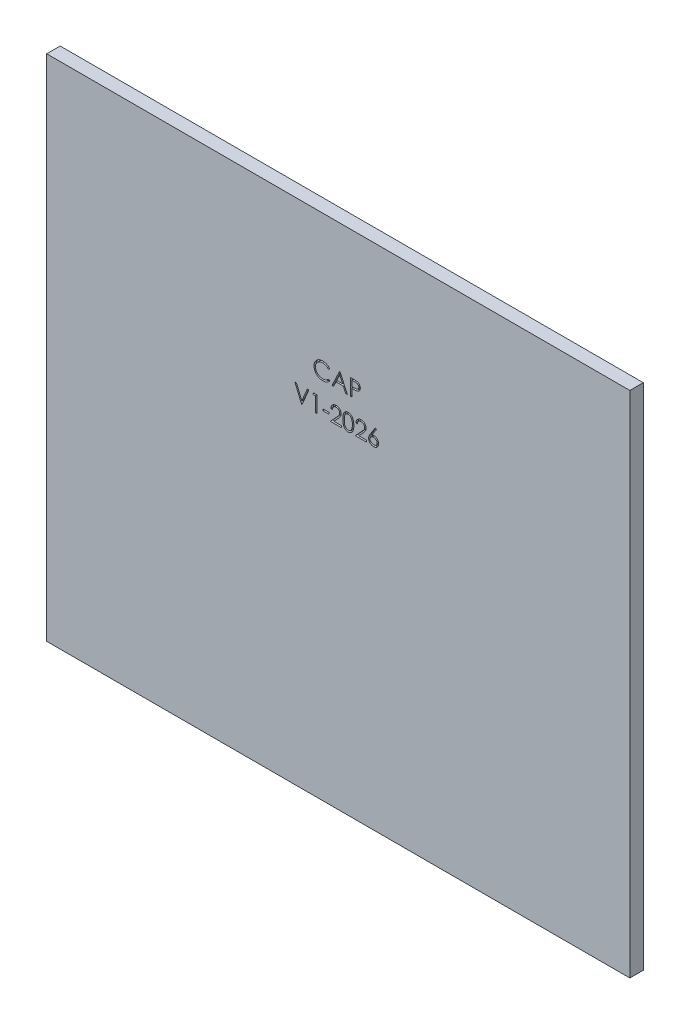
from build123d import *

# Parameters (mm, degrees)
ESQUISSE1_W             = 125.6
ESQUISSE1_H             = 109.6
BOSS_EXTRU_1_DEPTH      = 2.9
ESQUISSE6_W             = 1.346153846
ESQUISSE6_H             = 0.358974359
ENL_V_MAT_EXTRU_1_DEPTH = 0.5


with BuildPart() as part:
    # Esquisse1 → Boss.-Extru.1 (new body)
    with BuildSketch(Plane.XY):
        Rectangle(ESQUISSE1_W, ESQUISSE1_H)
    extrude(amount=BOSS_EXTRU_1_DEPTH)

    # Esquisse6 → Enlèv. mat.-Extru.1 (cut)
    # profile 1 of 10: a face of its own
    with BuildSketch(Plane.XY.offset(2.9)):
        with BuildLine():
            Line((-1.807578887, 26.491864512), (-2.08241863, 26.281527973))
            add(Edge.make_bspline(
                [(-2.08241863, 26.281527973), (-2.102024519, 26.304893943), (-2.140971966, 26.351310859), (-2.203631168, 26.416490403), (-2.268932811, 26.477555665), (-2.336851932, 26.534797544), (-2.408611052, 26.58621431), (-2.48247185, 26.634485413), (-2.559669896, 26.677753151), (-2.66642163, 26.730216137), (-2.806069478, 26.784962292), (-2.981864318, 26.830865523), (-3.165375416, 26.860086699), (-3.290573016, 26.863251541), (-3.354253566, 26.864861307)],
                knots=[0, 0, 0, 0, 0.757959112, 1.505699292, 2.245454638, 2.979532153, 3.711538275, 4.438200793, 5.171680507, 5.909471876, 7.393775596, 8.890124382, 10.418191784, 12, 12, 12, 12], degree=3))
            add(Edge.make_bspline(
                [(-3.354253566, 26.864861307), (-3.389336866, 26.864457344), (-3.459177858, 26.863653168), (-3.562826332, 26.853044043), (-3.664539383, 26.838132833), (-3.764250849, 26.81600751), (-3.861833808, 26.788034891), (-3.95792621, 26.754609477), (-4.051136809, 26.713254637), (-4.142755048, 26.667546377), (-4.230534259, 26.615918932), (-4.313589306, 26.55960558), (-4.391617274, 26.499236484), (-4.464679886, 26.434585377), (-4.532851835, 26.365943417), (-4.595639146, 26.292579075), (-4.652824556, 26.214726902), (-4.705541581, 26.133413494), (-4.752754314, 26.048875703), (-4.792284194, 25.960800632), (-4.827289316, 25.870696529), (-4.854988559, 25.777545368), (-4.876913075, 25.682002603), (-4.892040739, 25.583811815), (-4.90252921, 25.483178135), (-4.903329387, 25.414968822), (-4.903732733, 25.380586467)],
                knots=[0, 0, 0, 0, 1.054917814, 2.100044995, 3.131103042, 4.146048494, 5.169673617, 6.183595914, 7.203665975, 8.234915748, 9.262203917, 10.264457458, 11.251630812, 12.227803204, 13.197192746, 14.159520551, 15.12972552, 16.100847026, 17.073214652, 18.039054194, 19.002613845, 19.979014051, 20.95965708, 21.949030935, 22.966165397, 24, 24, 24, 24], degree=3))
            add(Edge.make_bspline(
                [(-4.903732733, 25.380586467), (-4.902470914, 25.328855147), (-4.8999935, 25.227287562), (-4.877945166, 25.078516952), (-4.844440074, 24.935996278), (-4.794224497, 24.800616435), (-4.732305447, 24.670708077), (-4.654064835, 24.548469224), (-4.563448298, 24.432052659), (-4.459173878, 24.324209712), (-4.344768062, 24.225695986), (-4.222020151, 24.138945405), (-4.091235863, 24.066630522), (-3.953859233, 24.006454576), (-3.808833119, 23.960197848), (-3.656418317, 23.927633725), (-3.496946321, 23.906391544), (-3.387976921, 23.904357856), (-3.332518791, 23.903322845)],
                knots=[0, 0, 0, 0, 1.029171465, 2.020641659, 2.987623507, 3.938342917, 4.889210282, 5.84687017, 6.821220943, 7.821438502, 8.827599549, 9.822697543, 10.807740252, 11.797342354, 12.80366471, 13.83203677, 14.896651826, 16, 16, 16, 16], degree=3))
            add(Edge.make_bspline(
                [(-3.332518791, 23.903322845), (-3.271416102, 23.905011625), (-3.151151393, 23.908335547), (-2.974783366, 23.936494796), (-2.805947601, 23.982152714), (-2.644635014, 24.046050637), (-2.491300368, 24.129115925), (-2.345703708, 24.229813802), (-2.207722137, 24.349102135), (-2.124750855, 24.440185263), (-2.08241863, 24.486656178)],
                knots=[0, 0, 0, 0, 1.028121516, 2.023589091, 2.998037872, 3.967518031, 4.937445131, 5.927275754, 6.942489185, 8, 8, 8, 8], degree=3))
            Line((-2.08241863, 24.486656178), (-1.807578887, 24.278423005))
            add(Edge.make_bspline(
                [(-1.807578887, 24.278423005), (-1.829696997, 24.249884553), (-1.873827272, 24.192944347), (-1.945285289, 24.112672637), (-2.020562586, 24.037168602), (-2.100218296, 23.967040981), (-2.183336088, 23.900886515), (-2.2714084, 23.840584684), (-2.363277433, 23.7852938), (-2.458631912, 23.734666875), (-2.557370524, 23.689749628), (-2.659374959, 23.65129586), (-2.764205535, 23.618170971), (-2.871867043, 23.590919034), (-2.9825828, 23.56964795), (-3.095953274, 23.555428275), (-3.212223149, 23.545686361), (-3.290664571, 23.544798445), (-3.330415425, 23.544348486)],
                knots=[0, 0, 0, 0, 0.986787822, 1.968848986, 2.935600012, 3.899624008, 4.868462664, 5.837806735, 6.815139263, 7.798259679, 8.787526145, 9.778297419, 10.776456485, 11.791383307, 12.812564526, 13.85620153, 14.913611965, 16, 16, 16, 16], degree=3))
            add(Edge.make_bspline(
                [(-3.330415425, 23.544348486), (-3.368059092, 23.544610479), (-3.442494782, 23.545128536), (-3.552393534, 23.553520704), (-3.659383115, 23.564970441), (-3.763157741, 23.582210572), (-3.864283716, 23.602554912), (-3.9618443, 23.629826169), (-4.056799511, 23.660375335), (-4.148767851, 23.696280322), (-4.237827551, 23.736796504), (-4.323691362, 23.782588063), (-4.406319795, 23.833269928), (-4.486525216, 23.887724938), (-4.563122799, 23.94770224), (-4.636776325, 24.012368875), (-4.707898801, 24.081506886), (-4.751901486, 24.131361739), (-4.774025201, 24.156427813)],
                knots=[0, 0, 0, 0, 1.114604814, 2.203992996, 3.262667896, 4.300477797, 5.318619304, 6.316056647, 7.298880507, 8.271930387, 9.238335007, 10.195173496, 11.151986948, 12.108099108, 13.064862484, 14.031167946, 15.010108607, 16, 16, 16, 16], degree=3))
            add(Edge.make_bspline(
                [(-4.774025201, 24.156427813), (-4.809460844, 24.199969002), (-4.879904321, 24.286525712), (-4.970030005, 24.426811694), (-5.04717756, 24.573279902), (-5.109553481, 24.726699831), (-5.158316214, 24.886727218), (-5.192097409, 25.053442733), (-5.214049013, 25.226690675), (-5.216559302, 25.344527464), (-5.217835297, 25.404424608)],
                knots=[0, 0, 0, 0, 0.994628077, 1.977248131, 2.950237994, 3.925870899, 4.908910175, 5.911660606, 6.938484602, 8, 8, 8, 8], degree=3))
            add(Edge.make_bspline(
                [(-5.217835297, 25.404424608), (-5.216280103, 25.467380061), (-5.213220357, 25.591240986), (-5.187224562, 25.773014939), (-5.145405766, 25.947166338), (-5.086008877, 26.113370083), (-5.010703526, 26.272500363), (-4.917676912, 26.423341568), (-4.80800977, 26.566858367), (-4.682562202, 26.700873119), (-4.544994867, 26.823412471), (-4.397676053, 26.931218675), (-4.240894106, 27.020936191), (-4.076376254, 27.095932354), (-3.902890573, 27.153576817), (-3.720807203, 27.193930003), (-3.530468289, 27.21904712), (-3.400605863, 27.222222328), (-3.334622156, 27.223835666)],
                knots=[0, 0, 0, 0, 1.032925535, 2.032216505, 3.007276963, 3.968222605, 4.92396291, 5.891752235, 6.871517503, 7.883894988, 8.900124299, 9.891468569, 10.874487609, 11.85992873, 12.854644235, 13.869047385, 14.917252991, 16, 16, 16, 16], degree=3))
            add(Edge.make_bspline(
                [(-3.334622156, 27.223835666), (-3.294407684, 27.223353527), (-3.214807187, 27.222399183), (-3.097054534, 27.213093041), (-2.982412207, 27.197579435), (-2.870801225, 27.176463365), (-2.761678609, 27.150256044), (-2.655878368, 27.116115745), (-2.552779681, 27.077079214), (-2.453032773, 27.032120748), (-2.357116223, 26.981654007), (-2.265059905, 26.926238383), (-2.177595046, 26.865942578), (-2.094106197, 26.801279402), (-2.015989986, 26.730880843), (-1.941028508, 26.656683247), (-1.87176743, 26.576549423), (-1.829014235, 26.520144489), (-1.807578887, 26.491864512)],
                knots=[0, 0, 0, 0, 1.096760587, 2.17092713, 3.219439832, 4.250915756, 5.268269357, 6.278326846, 7.281116186, 8.274029601, 9.260640565, 10.235837813, 11.203064059, 12.156899882, 13.114053108, 14.069676657, 15.032185724, 16, 16, 16, 16], degree=3))
        make_face()
    # profile 2 of 10: a face of its own
    with BuildSketch(Plane.XY.offset(2.9)):
        Polygon((0.346267267, 27.134092076), (1.961651882, 23.634092076), (1.620205568, 23.634092076), (1.102777684, 24.755886948), (-0.483860938, 24.755886948), (-1.015311259, 23.634092076), (-1.358860938, 23.634092076), (0.301395472, 27.134092076), align=None)
        Polygon((0.320325761, 26.451199448), (-0.31278722, 25.114861307), (0.93731294, 25.114861307), align=None, mode=Mode.SUBTRACT)
    # profile 3 of 10: a face of its own
    with BuildSketch(Plane.XY.offset(2.9)):
        with BuildLine():
            Line((2.589857011, 27.134092076), (3.276255248, 27.134092076))
            add(Edge.make_bspline(
                [(3.276255248, 27.134092076), (3.323466154, 27.13404018), (3.413924347, 27.133940744), (3.543639403, 27.130925998), (3.661449134, 27.126899306), (3.767099515, 27.121317413), (3.860915613, 27.114720823), (3.942472913, 27.105468783), (4.012412469, 27.095808488), (4.054318918, 27.085987081), (4.073430729, 27.081507941)],
                knots=[0, 0, 0, 0, 1.415646017, 2.712440637, 3.8905458, 4.950247383, 5.884950622, 6.709939814, 7.411656543, 8, 8, 8, 8], degree=3))
            add(Edge.make_bspline(
                [(4.073430729, 27.081507941), (4.097624262, 27.074885991), (4.14544124, 27.06179813), (4.214342283, 27.035584406), (4.279896128, 27.004502241), (4.342327687, 26.969078301), (4.40086977, 26.927792737), (4.456395811, 26.882319119), (4.508415791, 26.831607551), (4.556637183, 26.776226811), (4.60092198, 26.717106601), (4.639051663, 26.653364371), (4.67097889, 26.586073068), (4.698362162, 26.515279496), (4.718070616, 26.440389173), (4.732917516, 26.361922461), (4.742341143, 26.27988777), (4.743243705, 26.223827903), (4.743703165, 26.195289992)],
                knots=[0, 0, 0, 0, 0.999701418, 1.975846123, 2.934577507, 3.890451536, 4.834027766, 5.787354733, 6.749476667, 7.726910423, 8.712836071, 9.690891519, 10.682875813, 11.679750201, 12.712814741, 13.765529915, 14.8625177, 16, 16, 16, 16], degree=3))
            add(Edge.make_bspline(
                [(4.743703165, 26.195289992), (4.74328174, 26.166512216), (4.742457194, 26.110206552), (4.732560909, 26.027833764), (4.719230717, 25.949115373), (4.698733665, 25.874225923), (4.671887991, 25.803610152), (4.640395939, 25.73618892), (4.602412408, 25.673109249), (4.558767579, 25.614142131), (4.510215984, 25.559232219), (4.456963046, 25.508777424), (4.399223754, 25.463073086), (4.337181605, 25.422016742), (4.270231757, 25.386560463), (4.199389603, 25.354803158), (4.124039387, 25.328132097), (4.071896873, 25.314102036), (4.045385857, 25.306968678)],
                knots=[0, 0, 0, 0, 1.121902311, 2.195077645, 3.232258892, 4.234102512, 5.217864754, 6.176164875, 7.132989551, 8.084763148, 9.034132444, 9.988522005, 10.94243251, 11.903244335, 12.886203696, 13.894208494, 14.929344452, 16, 16, 16, 16], degree=3))
            add(Edge.make_bspline(
                [(4.045385857, 25.306968678), (4.023458523, 25.302305697), (3.975403495, 25.292086503), (3.896260773, 25.280678046), (3.804115387, 25.270940446), (3.699093107, 25.263639308), (3.581288203, 25.25738894), (3.450636945, 25.252420846), (3.306882868, 25.249690992), (3.206611624, 25.249550199), (3.154260056, 25.249476691)],
                knots=[0, 0, 0, 0, 0.601384939, 1.31797006, 2.144135048, 3.087295005, 4.142315834, 5.309527816, 6.595305764, 8, 8, 8, 8], degree=3))
            Line((3.154260056, 25.249476691), (2.903959575, 25.249476691))
            Line((2.903959575, 25.249476691), (2.903959575, 23.634092076))
            Line((2.903959575, 23.634092076), (2.589857011, 23.634092076))
            Line((2.589857011, 23.634092076), (2.589857011, 27.134092076))
        make_face()
        with BuildLine():
            Line((2.903959575, 26.775117717), (2.903959575, 25.60845105))
            Line((2.903959575, 25.60845105), (3.516740023, 25.60073871))
            add(Edge.make_bspline(
                [(3.516740023, 25.60073871), (3.546659949, 25.600723247), (3.604419749, 25.600693395), (3.687855972, 25.604678618), (3.76526526, 25.609279151), (3.836409835, 25.616015074), (3.90132177, 25.625536332), (3.960109299, 25.63514807), (4.012316581, 25.649053432), (4.073415783, 25.667776501), (4.141499131, 25.699709117), (4.215566679, 25.746059007), (4.278337266, 25.805139715), (4.332655562, 25.871567547), (4.37576144, 25.945466676), (4.407317433, 26.024535613), (4.42585859, 26.107963462), (4.428344784, 26.165051601), (4.4296006, 26.193887749)],
                knots=[0, 0, 0, 0, 1.160613943, 2.240541288, 3.23993089, 4.169200891, 5.011653406, 5.7853311, 6.478053781, 7.106038997, 8.262395093, 9.384106736, 10.481365981, 11.59014053, 12.70357646, 13.786202915, 14.881775077, 16, 16, 16, 16], degree=3))
            add(Edge.make_bspline(
                [(4.4296006, 26.193887749), (4.428337954, 26.222026262), (4.425827969, 26.277962145), (4.407172106, 26.359940905), (4.375822792, 26.43817661), (4.332366197, 26.511149695), (4.279625067, 26.577338499), (4.218325724, 26.634835626), (4.148612463, 26.681057329), (4.083764232, 26.71089061), (4.026163046, 26.729105886), (3.976131086, 26.741850726), (3.919640412, 26.752026332), (3.856672632, 26.760265835), (3.787715798, 26.767319296), (3.712177483, 26.772105274), (3.63034384, 26.77490673), (3.573533269, 26.775045685), (3.544083773, 26.775117717)],
                knots=[0, 0, 0, 0, 1.120700087, 2.227813068, 3.331159281, 4.466773991, 5.599788987, 6.693661531, 7.80175334, 8.91857717, 9.525282508, 10.207424825, 10.974604443, 11.810962634, 12.737642355, 13.736264703, 14.826523623, 16, 16, 16, 16], degree=3))
            Line((3.544083773, 26.775117717), (2.903959575, 26.775117717))
        make_face(mode=Mode.SUBTRACT)
    # profile 4 of 10: a face of its own
    with BuildSketch(Plane.XY.offset(2.9)):
        Polygon((-9.346040425, 20.300758742), (-9.009501964, 20.300758742), (-7.843536419, 17.544648967), (-6.676869752, 20.300758742), (-6.339630169, 20.300758742), (-7.8203994, 16.800758742), (-7.865271194, 16.800758742), align=None)
    # profile 5 of 10: a face of its own
    with BuildSketch(Plane.XY.offset(2.9)):
        Polygon((-5.28163738, 20.300758742), (-4.634501964, 20.300758742), (-4.634501964, 16.800758742), (-4.948604528, 16.800758742), (-4.948604528, 19.941784384), (-5.487066066, 19.941784384), align=None)
    # profile 6 of 10: a face of its own
    with BuildSketch(Plane.XY.offset(2.9)):
        with Locations((-2.660142989, 18.146912589)):
            Rectangle(ESQUISSE6_W, ESQUISSE6_H)
    # profile 7 of 10: a face of its own
    with BuildSketch(Plane.XY.offset(2.9)):
        with BuildLine():
            Line((-1.269117348, 19.223835666), (-1.583219912, 19.223835666))
            add(Edge.make_bspline(
                [(-1.583219912, 19.223835666), (-1.581172759, 19.265506553), (-1.577152205, 19.347347068), (-1.558323916, 19.466670974), (-1.531383039, 19.580725773), (-1.493291585, 19.688595687), (-1.445985307, 19.791234494), (-1.38925528, 19.88823451), (-1.322061429, 19.979225699), (-1.245854695, 20.063364542), (-1.163086056, 20.140552113), (-1.073780117, 20.207207356), (-0.979935089, 20.263525027), (-0.88183569, 20.310606269), (-0.778375127, 20.345946115), (-0.670492269, 20.372167754), (-0.557713133, 20.3879441), (-0.480873111, 20.389639886), (-0.44179363, 20.390502332)],
                knots=[0, 0, 0, 0, 1.10065271, 2.161652631, 3.183658789, 4.190468796, 5.17591951, 6.163126047, 7.15150782, 8.156236427, 9.156009102, 10.134482811, 11.092018607, 12.041330605, 13.001268258, 13.972401359, 14.968799086, 16, 16, 16, 16], degree=3))
            add(Edge.make_bspline(
                [(-0.44179363, 20.390502332), (-0.403415556, 20.389603876), (-0.328004012, 20.387838441), (-0.217941997, 20.372677412), (-0.113164703, 20.34893182), (-0.013876936, 20.315616404), (0.079129128, 20.270831976), (0.166552173, 20.217034438), (0.249432984, 20.154814606), (0.324039767, 20.081560793), (0.392547847, 20.003358408), (0.451650102, 19.919870505), (0.502263265, 19.833641219), (0.544450945, 19.744013018), (0.575507084, 19.650141989), (0.599085292, 19.553394786), (0.612412706, 19.452769975), (0.614458129, 19.38466342), (0.615498036, 19.350037589)],
                knots=[0, 0, 0, 0, 1.111607364, 2.184268762, 3.212621178, 4.221274766, 5.211760367, 6.196651075, 7.1921475, 8.207485113, 9.220403448, 10.201281604, 11.166441695, 12.114753415, 13.065576456, 14.026450734, 14.996634279, 16, 16, 16, 16], degree=3))
            add(Edge.make_bspline(
                [(0.615498036, 19.350037589), (0.613811391, 19.301287779), (0.6104677, 19.204643651), (0.581611997, 19.062439294), (0.5370299, 18.924534234), (0.482956871, 18.813555182), (0.428336303, 18.724578289), (0.380156508, 18.650662648), (0.322504155, 18.571836231), (0.255906742, 18.487305122), (0.181368935, 18.396810752), (0.098354268, 18.300315986), (0.006228577, 18.198845681), (-0.058429605, 18.129539868), (-0.091933855, 18.093627332)],
                knots=[0, 0, 0, 0, 1.184203166, 2.347625244, 3.513805382, 4.700623107, 5.337941753, 6.051866363, 6.845199593, 7.711357327, 8.668078039, 9.695487809, 10.805859518, 12, 12, 12, 12], degree=3))
            Line((-0.091933855, 18.093627332), (-0.967634977, 17.159733101))
            Line((-0.967634977, 17.159733101), (0.660369831, 17.159733101))
            Line((0.660369831, 17.159733101), (0.660369831, 16.800758742))
            Line((0.660369831, 16.800758742), (-1.717835297, 16.800758742))
            Line((-1.717835297, 16.800758742), (-0.360463502, 18.249276371))
            add(Edge.make_bspline(
                [(-0.360463502, 18.249276371), (-0.327415615, 18.283774677), (-0.263937388, 18.350038864), (-0.174154811, 18.446781824), (-0.093515823, 18.536531365), (-0.02149843, 18.619117913), (0.040335075, 18.695749481), (0.095207307, 18.763944185), (0.139172898, 18.826698635), (0.186888294, 18.899439249), (0.233102275, 18.988251566), (0.272814631, 19.096785255), (0.29702948, 19.208512508), (0.299934315, 19.284014545), (0.301395472, 19.321992717)],
                knots=[0, 0, 0, 0, 1.329631726, 2.553950428, 3.673215718, 4.687767853, 5.603093632, 6.413772471, 7.123043292, 7.734684054, 8.834405432, 9.900288307, 10.943827018, 12, 12, 12, 12], degree=3))
            add(Edge.make_bspline(
                [(0.301395472, 19.321992717), (0.30075973, 19.345874115), (0.299506804, 19.392939766), (0.288449106, 19.461945525), (0.2717386, 19.528510338), (0.247793342, 19.592838958), (0.216186602, 19.65428461), (0.177713222, 19.71292209), (0.133323159, 19.769611055), (0.08197189, 19.822764353), (0.02556037, 19.871445559), (-0.03403388, 19.914569644), (-0.097083984, 19.950608755), (-0.163324106, 19.980152252), (-0.232569576, 20.003327633), (-0.304954321, 20.019386213), (-0.380278337, 20.029468697), (-0.431711833, 20.030832868), (-0.457919432, 20.031527973)],
                knots=[0, 0, 0, 0, 0.991446411, 1.95395049, 2.89581595, 3.838931463, 4.798493298, 5.75982156, 6.748411868, 7.785213223, 8.824556874, 9.840280684, 10.836137867, 11.835679398, 12.848801643, 13.863922112, 14.911575587, 16, 16, 16, 16], degree=3))
            add(Edge.make_bspline(
                [(-0.457919432, 20.031527973), (-0.485290264, 20.030812941), (-0.539042061, 20.029408736), (-0.617961094, 20.019586072), (-0.693246871, 20.002640231), (-0.765088774, 19.979463557), (-0.83360836, 19.950005008), (-0.898472404, 19.913313263), (-0.959535293, 19.86952977), (-1.016911816, 19.819889214), (-1.069775796, 19.764621613), (-1.116222671, 19.70301165), (-1.156806686, 19.636184234), (-1.192215919, 19.564319684), (-1.220971609, 19.486765904), (-1.24294476, 19.403798199), (-1.260331606, 19.315776817), (-1.266140127, 19.254991733), (-1.269117348, 19.223835666)],
                knots=[0, 0, 0, 0, 1.031018746, 2.02475058, 2.990194455, 3.934040569, 4.864654155, 5.795059489, 6.735614925, 7.690564532, 8.649604399, 9.611025574, 10.590972636, 11.591080095, 12.624614302, 13.701020113, 14.821632451, 16, 16, 16, 16], degree=3))
        make_face()
    # profile 8 of 10: a face of its own
    with BuildSketch(Plane.XY.offset(2.9)):
        with BuildLine():
            add(Edge.make_bspline(
                [(0.974472395, 18.549356499), (0.974800413, 18.605453887), (0.975437593, 18.714423871), (0.982526014, 18.873208513), (0.994301357, 19.022168802), (1.01043873, 19.161311868), (1.03007671, 19.290673633), (1.056292196, 19.40990839), (1.086104999, 19.519567996), (1.120657445, 19.620010045), (1.159645234, 19.712587748), (1.202079495, 19.799012949), (1.249644289, 19.879154881), (1.299621202, 19.954292672), (1.354033274, 20.023196367), (1.411332064, 20.086839029), (1.47375394, 20.14374978), (1.539176949, 20.195596082), (1.608193413, 20.241045554), (1.678836079, 20.281078292), (1.751591185, 20.31527816), (1.826657368, 20.342168595), (1.903359926, 20.364379442), (1.981966992, 20.37956839), (2.062608356, 20.389125298), (2.117039791, 20.390038966), (2.144644671, 20.390502332)],
                knots=[0, 0, 0, 0, 1.646270934, 3.197905019, 4.663502075, 6.030701355, 7.308322542, 8.50163776, 9.611534131, 10.641858119, 11.616356847, 12.558055219, 13.465016945, 14.349605745, 15.204443733, 16.039544428, 16.859896111, 17.680448484, 18.487036065, 19.28249412, 20.06191084, 20.843045899, 21.620316918, 22.403196591, 23.190181807, 24, 24, 24, 24], degree=3))
            add(Edge.make_bspline(
                [(2.144644671, 20.390502332), (2.172480149, 20.390014517), (2.227836158, 20.389044406), (2.309676534, 20.379720464), (2.389626215, 20.364249341), (2.467344354, 20.342328366), (2.54346934, 20.315132689), (2.617405748, 20.281045572), (2.68961283, 20.241366705), (2.758943117, 20.194742828), (2.826157733, 20.142760551), (2.889605696, 20.083997883), (2.949292781, 20.019048163), (3.005968087, 19.948606299), (3.058023684, 19.871321215), (3.107597116, 19.788537105), (3.151969152, 19.69880624), (3.194703827, 19.603625772), (3.231590814, 19.500362113), (3.264857059, 19.389597353), (3.291736028, 19.270023166), (3.3141253, 19.142266921), (3.331470196, 19.005859437), (3.344102838, 18.861093122), (3.350775923, 18.707872731), (3.352032625, 18.603114882), (3.352677523, 18.549356499)],
                knots=[0, 0, 0, 0, 0.810914788, 1.612654377, 2.396697861, 3.181598691, 3.963628158, 4.749916497, 5.551656086, 6.361998678, 7.18212741, 8.025565596, 8.878627764, 9.750805457, 10.657531673, 11.591944965, 12.560506719, 13.57287815, 14.630710178, 15.753379473, 16.941251878, 18.199788006, 19.531962791, 20.947069417, 22.433333509, 24, 24, 24, 24], degree=3))
            add(Edge.make_bspline(
                [(3.352677523, 18.549356499), (3.352025939, 18.495832591), (3.350756353, 18.391543439), (3.344177646, 18.239012464), (3.331219015, 18.09501442), (3.315009027, 17.959203958), (3.292558064, 17.832146339), (3.264952898, 17.713401891), (3.234302575, 17.602457819), (3.196467781, 17.500223007), (3.15505707, 17.405271285), (3.110001874, 17.316604136), (3.061732048, 17.233437844), (3.009143303, 17.156438097), (2.95308989, 17.08505944), (2.892372101, 17.020561817), (2.828701516, 16.961391145), (2.7612891, 16.908739517), (2.690877549, 16.862654713), (2.618918472, 16.821440862), (2.544135089, 16.788208167), (2.468222136, 16.759673126), (2.39009377, 16.737872675), (2.309847379, 16.722798819), (2.227891143, 16.712226971), (2.172489578, 16.711420491), (2.144644671, 16.711015153)],
                knots=[0, 0, 0, 0, 1.561518951, 3.042555995, 4.452378317, 5.7783523, 7.031515105, 8.214008947, 9.334062868, 10.386615937, 11.391082383, 12.354592575, 13.286541444, 14.194233754, 15.072674879, 15.931287219, 16.775624067, 17.606195743, 18.42308326, 19.229000347, 20.022332153, 20.807536673, 21.593273796, 22.3848459, 23.188221202, 24, 24, 24, 24], degree=3))
            add(Edge.make_bspline(
                [(2.144644671, 16.711015153), (2.117040557, 16.711481508), (2.062610632, 16.71240107), (1.981958207, 16.721914802), (1.903675763, 16.737210305), (1.827377009, 16.758626909), (1.752670494, 16.784841745), (1.680574208, 16.818995429), (1.610286524, 16.858329498), (1.541994968, 16.903124919), (1.476982807, 16.954446602), (1.414884201, 17.011210891), (1.357259182, 17.074834302), (1.303625087, 17.144312225), (1.252650999, 17.219005468), (1.205761625, 17.299933841), (1.162390771, 17.386776451), (1.12274728, 17.480094362), (1.087598617, 17.58124929), (1.056550909, 17.691398468), (1.032036751, 17.811514104), (1.011053796, 17.940631472), (0.994129413, 18.079305402), (0.982575088, 18.22761118), (0.975433773, 18.385456389), (0.974798702, 18.493726163), (0.974472395, 18.549356499)],
                knots=[0, 0, 0, 0, 0.810891512, 1.598919785, 2.382837074, 3.152667961, 3.926044502, 4.706494248, 5.493654104, 6.291793342, 7.103789334, 7.925228297, 8.761435821, 9.622817696, 10.50288917, 11.416980706, 12.369136599, 13.353924996, 14.394355917, 15.514179734, 16.714354668, 17.994756427, 19.357759367, 20.818452758, 22.365282078, 24, 24, 24, 24], degree=3))
        make_face()
        with BuildLine():
            add(Edge.make_bspline(
                [(1.288574959, 18.550758742), (1.288694406, 18.504010044), (1.28892623, 18.413279999), (1.29498243, 18.281436738), (1.303232662, 18.158466409), (1.31387396, 18.044212873), (1.329676908, 17.93906286), (1.347383696, 17.842293177), (1.368931785, 17.75441594), (1.394426803, 17.674828129), (1.4234659, 17.602179061), (1.455171764, 17.534577846), (1.489232487, 17.471225909), (1.527351637, 17.412692301), (1.568866701, 17.358786137), (1.61283996, 17.308553304), (1.660912544, 17.263756323), (1.727416287, 17.210029468), (1.815212761, 17.154510334), (1.925833216, 17.106164244), (2.039501667, 17.075781788), (2.116652917, 17.071918032), (2.155161498, 17.069989512)],
                knots=[0, 0, 0, 0, 1.459021318, 2.831673884, 4.118529203, 5.306027144, 6.411944654, 7.436330062, 8.375795394, 9.233974572, 10.042671642, 10.816086306, 11.563610507, 12.285937304, 12.993564865, 13.685989202, 14.367179055, 15.041617293, 16.353048772, 17.594441528, 18.799311195, 20, 20, 20, 20], degree=3))
            add(Edge.make_bspline(
                [(2.155161498, 17.069989512), (2.19391917, 17.071587293), (2.271354493, 17.074779555), (2.384488288, 17.105578293), (2.494318558, 17.152047832), (2.580390498, 17.206995338), (2.645873042, 17.259323667), (2.692790032, 17.303938315), (2.73585208, 17.353894183), (2.776694155, 17.407793479), (2.814153231, 17.466665963), (2.848216368, 17.530228538), (2.879299716, 17.598657716), (2.897008762, 17.646427455), (2.90606294, 17.67085089)],
                knots=[0, 0, 0, 0, 1.353760809, 2.704726607, 4.075137775, 5.516104923, 6.260822281, 7.007110065, 7.778089737, 8.566572457, 9.372053459, 10.217411131, 11.088608312, 12, 12, 12, 12], degree=3))
            add(Edge.make_bspline(
                [(2.90606294, 17.67085089), (2.916614708, 17.702080629), (2.938039322, 17.765490394), (2.965651096, 17.863854046), (2.987396495, 17.96705681), (3.006959861, 18.074481926), (3.020312917, 18.186921627), (3.03106073, 18.304028011), (3.037391417, 18.425889374), (3.038176168, 18.508684365), (3.038574959, 18.550758742)],
                knots=[0, 0, 0, 0, 0.884706709, 1.796334032, 2.740027952, 3.714592787, 4.726048262, 5.777819803, 6.87074269, 8, 8, 8, 8], degree=3))
            add(Edge.make_bspline(
                [(3.038574959, 18.550758742), (3.03802477, 18.592826315), (3.036948482, 18.67511948), (3.032834495, 18.79563766), (3.02221092, 18.910105421), (3.010411801, 19.019015894), (2.99301458, 19.121766197), (2.974256773, 19.219216502), (2.949055561, 19.310159527), (2.922135786, 19.396019109), (2.891325391, 19.475819763), (2.857409656, 19.549933549), (2.821187898, 19.618718274), (2.781845657, 19.681985216), (2.739849974, 19.740017759), (2.694092425, 19.791652353), (2.646388052, 19.838489321), (2.579570866, 19.89195189), (2.492096576, 19.946463586), (2.383250929, 19.996629346), (2.269980285, 20.025437638), (2.193406831, 20.029499325), (2.155161498, 20.031527973)],
                knots=[0, 0, 0, 0, 1.31362396, 2.569729283, 3.763502607, 4.902122613, 5.988968491, 7.01645872, 7.998833611, 8.933434873, 9.825090667, 10.667526885, 11.477055099, 12.250526234, 12.991942729, 13.710640831, 14.402115721, 15.076753259, 16.378508321, 17.609869233, 18.806226677, 20, 20, 20, 20], degree=3))
            add(Edge.make_bspline(
                [(2.155161498, 20.031527973), (2.116450906, 20.029496527), (2.0389592, 20.025429933), (1.924511245, 19.996736679), (1.814806894, 19.946723713), (1.727563919, 19.891771341), (1.660700133, 19.839433029), (1.613617439, 19.794046575), (1.569471267, 19.744400321), (1.528803567, 19.689998406), (1.490714284, 19.631533038), (1.455733271, 19.568544274), (1.424215941, 19.50071291), (1.395131405, 19.428096474), (1.369558617, 19.34851553), (1.348464654, 19.260746536), (1.328977601, 19.164284644), (1.315182332, 19.058565136), (1.302918576, 18.944282983), (1.295037228, 18.821005665), (1.288905971, 18.688941284), (1.288687506, 18.597742126), (1.288574959, 18.550758742)],
                knots=[0, 0, 0, 0, 1.207732386, 2.417664972, 3.655092373, 4.956220595, 5.625982001, 6.301752483, 6.994047911, 7.697131622, 8.419323945, 9.170223765, 9.943494443, 10.752040957, 11.610060368, 12.549350801, 13.567764191, 14.679664412, 15.874934091, 17.154273443, 18.533957287, 20, 20, 20, 20], degree=3))
        make_face(mode=Mode.SUBTRACT)
    # profile 9 of 10: a face of its own
    with BuildSketch(Plane.XY.offset(2.9)):
        with BuildLine():
            Line((4.115498036, 19.223835666), (3.801395472, 19.223835666))
            add(Edge.make_bspline(
                [(3.801395472, 19.223835666), (3.803442625, 19.265506553), (3.807463179, 19.347347068), (3.826291469, 19.466670974), (3.853232346, 19.580725773), (3.8913238, 19.688595687), (3.938630078, 19.791234494), (3.995360105, 19.88823451), (4.062553955, 19.979225699), (4.138760689, 20.063364542), (4.221529328, 20.140552113), (4.310835268, 20.207207356), (4.404680295, 20.263525027), (4.502779694, 20.310606269), (4.606240258, 20.345946115), (4.714123116, 20.372167754), (4.826902252, 20.3879441), (4.903742274, 20.389639886), (4.942821754, 20.390502332)],
                knots=[0, 0, 0, 0, 1.10065271, 2.161652631, 3.183658789, 4.190468796, 5.17591951, 6.163126047, 7.15150782, 8.156236427, 9.156009102, 10.134482811, 11.092018607, 12.041330605, 13.001268258, 13.972401359, 14.968799086, 16, 16, 16, 16], degree=3))
            add(Edge.make_bspline(
                [(4.942821754, 20.390502332), (4.981199828, 20.389603876), (5.056611373, 20.387838441), (5.166673387, 20.372677412), (5.271450682, 20.34893182), (5.370738448, 20.315616404), (5.463744513, 20.270831976), (5.551167558, 20.217034438), (5.634048368, 20.154814606), (5.708655152, 20.081560793), (5.777163231, 20.003358408), (5.836265486, 19.919870505), (5.88687865, 19.833641219), (5.92906633, 19.744013018), (5.960122469, 19.650141989), (5.983700677, 19.553394786), (5.99702809, 19.452769975), (5.999073514, 19.38466342), (6.000113421, 19.350037589)],
                knots=[0, 0, 0, 0, 1.111607364, 2.184268762, 3.212621178, 4.221274766, 5.211760367, 6.196651075, 7.1921475, 8.207485113, 9.220403448, 10.201281604, 11.166441695, 12.114753415, 13.065576456, 14.026450734, 14.996634279, 16, 16, 16, 16], degree=3))
            add(Edge.make_bspline(
                [(6.000113421, 19.350037589), (5.998426776, 19.301287779), (5.995083084, 19.204643651), (5.966227382, 19.062439294), (5.921645285, 18.924534234), (5.867572256, 18.813555182), (5.812951688, 18.724578289), (5.764771892, 18.650662648), (5.707119539, 18.571836231), (5.640522126, 18.487305122), (5.56598432, 18.396810752), (5.482969652, 18.300315986), (5.390843962, 18.198845681), (5.32618578, 18.129539868), (5.29268153, 18.093627332)],
                knots=[0, 0, 0, 0, 1.184203166, 2.347625244, 3.513805382, 4.700623107, 5.337941753, 6.051866363, 6.845199593, 7.711357327, 8.668078039, 9.695487809, 10.805859518, 12, 12, 12, 12], degree=3))
            Line((5.29268153, 18.093627332), (4.416980408, 17.159733101))
            Line((4.416980408, 17.159733101), (6.044985216, 17.159733101))
            Line((6.044985216, 17.159733101), (6.044985216, 16.800758742))
            Line((6.044985216, 16.800758742), (3.666780088, 16.800758742))
            Line((3.666780088, 16.800758742), (5.024151882, 18.249276371))
            add(Edge.make_bspline(
                [(5.024151882, 18.249276371), (5.057199769, 18.283774677), (5.120677996, 18.350038864), (5.210460573, 18.446781824), (5.291099562, 18.536531365), (5.363116954, 18.619117913), (5.42495046, 18.695749481), (5.479822692, 18.763944185), (5.523788283, 18.826698635), (5.571503678, 18.899439249), (5.61771766, 18.988251566), (5.657430016, 19.096785255), (5.681644864, 19.208512508), (5.6845497, 19.284014545), (5.686010857, 19.321992717)],
                knots=[0, 0, 0, 0, 1.329631726, 2.553950428, 3.673215718, 4.687767853, 5.603093632, 6.413772471, 7.123043292, 7.734684054, 8.834405432, 9.900288307, 10.943827018, 12, 12, 12, 12], degree=3))
            add(Edge.make_bspline(
                [(5.686010857, 19.321992717), (5.685375115, 19.345874115), (5.684122189, 19.392939766), (5.673064491, 19.461945525), (5.656353985, 19.528510338), (5.632408727, 19.592838958), (5.600801987, 19.65428461), (5.562328607, 19.71292209), (5.517938543, 19.769611055), (5.466587274, 19.822764353), (5.410175754, 19.871445559), (5.350581505, 19.914569644), (5.287531401, 19.950608755), (5.221291278, 19.980152252), (5.152045809, 20.003327633), (5.079661064, 20.019386213), (5.004337048, 20.029468697), (4.952903552, 20.030832868), (4.926695953, 20.031527973)],
                knots=[0, 0, 0, 0, 0.991446411, 1.95395049, 2.89581595, 3.838931463, 4.798493298, 5.75982156, 6.748411868, 7.785213223, 8.824556874, 9.840280684, 10.836137867, 11.835679398, 12.848801643, 13.863922112, 14.911575587, 16, 16, 16, 16], degree=3))
            add(Edge.make_bspline(
                [(4.926695953, 20.031527973), (4.89932512, 20.030812941), (4.845573324, 20.029408736), (4.766654291, 20.019586072), (4.691368514, 20.002640231), (4.619526611, 19.979463557), (4.551007025, 19.950005008), (4.486142981, 19.913313263), (4.425080091, 19.86952977), (4.367703568, 19.819889214), (4.314839589, 19.764621613), (4.268392713, 19.70301165), (4.227808699, 19.636184234), (4.192399466, 19.564319684), (4.163643776, 19.486765904), (4.141670625, 19.403798199), (4.124283778, 19.315776817), (4.118475258, 19.254991733), (4.115498036, 19.223835666)],
                knots=[0, 0, 0, 0, 1.031018746, 2.02475058, 2.990194455, 3.934040569, 4.864654155, 5.795059489, 6.735614925, 7.690564532, 8.649604399, 9.611025574, 10.590972636, 11.591080095, 12.624614302, 13.701020113, 14.821632451, 16, 16, 16, 16], degree=3))
        make_face()
    # profile 10 of 10: a face of its own
    with BuildSketch(Plane.XY.offset(2.9)):
        with BuildLine():
            Line((7.974472395, 20.390502332), (8.217060536, 20.200498326))
            Line((8.217060536, 20.200498326), (7.292280889, 18.786335666))
            add(Edge.make_bspline(
                [(7.292280889, 18.786335666), (7.353851166, 18.796149526), (7.473950953, 18.815292571), (7.595516851, 18.818450516), (7.654760857, 18.819989512)],
                knots=[0, 0, 0, 0, 1.025318673, 2, 2, 2, 2], degree=3))
            add(Edge.make_bspline(
                [(7.654760857, 18.819989512), (7.690335143, 18.819047248), (7.760130452, 18.817198564), (7.862684886, 18.802588984), (7.961252279, 18.779849254), (8.055612741, 18.746568277), (8.145886029, 18.704068245), (8.232588342, 18.653128744), (8.314090375, 18.591123237), (8.391441548, 18.521858233), (8.461668647, 18.445141261), (8.523844702, 18.363739921), (8.576071494, 18.277739041), (8.618445416, 18.187182175), (8.651350294, 18.092208916), (8.675337939, 17.992940776), (8.689517532, 17.889309305), (8.691443023, 17.818831129), (8.692421113, 17.783030377)],
                knots=[0, 0, 0, 0, 1.044136307, 2.048553127, 3.035567123, 4.010001674, 4.980053131, 5.96154148, 6.956538004, 7.981742224, 9.006487041, 10.005615874, 10.984750588, 11.954802044, 12.935714515, 13.930994945, 14.949008866, 16, 16, 16, 16], degree=3))
            add(Edge.make_bspline(
                [(8.692421113, 17.783030377), (8.690998008, 17.734050673), (8.688197675, 17.637670207), (8.660293879, 17.497293501), (8.616934234, 17.363560985), (8.554956706, 17.238607814), (8.477974323, 17.122605244), (8.38409673, 17.019819779), (8.276653242, 16.928149742), (8.155166443, 16.851493122), (8.024423479, 16.788890071), (7.887071482, 16.743924829), (7.744444336, 16.71624136), (7.647639727, 16.712770757), (7.598671113, 16.711015153)],
                knots=[0, 0, 0, 0, 1.031375318, 2.029502543, 3.004789286, 3.987476834, 4.960371455, 5.9300674, 6.912260825, 7.929083631, 8.949397511, 9.960523116, 10.96833055, 12, 12, 12, 12], degree=3))
            add(Edge.make_bspline(
                [(7.598671113, 16.711015153), (7.551574413, 16.712543358), (7.458284095, 16.715570467), (7.3210513, 16.742536404), (7.189188283, 16.786243507), (7.063618902, 16.846457786), (6.947298289, 16.922515669), (6.843232653, 17.014077948), (6.751940878, 17.119187413), (6.675966257, 17.23782776), (6.615707525, 17.365317718), (6.5705176, 17.498254874), (6.544121357, 17.636154856), (6.5404328, 17.729635995), (6.538574959, 17.776720281)],
                knots=[0, 0, 0, 0, 1.012016664, 2.004627821, 2.994792927, 3.992885782, 4.990978636, 5.973936114, 6.964471063, 7.975201453, 8.993600317, 9.990122807, 10.98767138, 12, 12, 12, 12], degree=3))
            add(Edge.make_bspline(
                [(6.538574959, 17.776720281), (6.539756404, 17.812764864), (6.542168689, 17.886361016), (6.55901208, 17.997825044), (6.586076874, 18.111876126), (6.616387121, 18.208630319), (6.648412731, 18.287891841), (6.67506527, 18.351795332), (6.708239267, 18.417556405), (6.743612648, 18.487430041), (6.784369517, 18.559615474), (6.828685166, 18.635319143), (6.877784817, 18.713337071), (6.91220498, 18.766281266), (6.929800921, 18.793346884)],
                knots=[0, 0, 0, 0, 1.173818275, 2.396712641, 3.66331629, 4.989737886, 5.693666774, 6.447286557, 7.243889047, 8.091586357, 8.998013824, 9.943181721, 10.948533338, 12, 12, 12, 12], degree=3))
            Line((6.929800921, 18.793346884), (7.974472395, 20.390502332))
        make_face()
        with BuildLine():
            add(Edge.make_bspline(
                [(7.588855408, 18.461015153), (7.562194016, 18.460226784), (7.509884584, 18.458680012), (7.433235625, 18.449944284), (7.360889264, 18.433391085), (7.292014399, 18.41198356), (7.227346185, 18.382819424), (7.166082941, 18.347872505), (7.108929772, 18.306003028), (7.056165671, 18.258737114), (7.008351448, 18.206939816), (6.967168901, 18.151472706), (6.931646868, 18.093657878), (6.902764952, 18.033016101), (6.880274903, 17.969569557), (6.864006645, 17.903610319), (6.854952895, 17.83469601), (6.853446664, 17.787963508), (6.852677523, 17.764100089)],
                knots=[0, 0, 0, 0, 1.128956033, 2.215002439, 3.259141796, 4.2666399, 5.263148119, 6.255916712, 7.247353359, 8.256307737, 9.250603402, 10.226115518, 11.176314381, 12.118911324, 13.063945463, 14.021379252, 14.989639887, 16, 16, 16, 16], degree=3))
            add(Edge.make_bspline(
                [(6.852677523, 17.764100089), (6.853303885, 17.740450109), (6.854532087, 17.694076019), (6.865684406, 17.625736839), (6.882719489, 17.559971931), (6.908059885, 17.497120332), (6.938286773, 17.436224014), (6.978192097, 17.379488729), (7.022408883, 17.323468659), (7.075262816, 17.272467187), (7.131986179, 17.225010563), (7.192587382, 17.18353031), (7.255747342, 17.148044136), (7.322318764, 17.120233039), (7.391357148, 17.097408752), (7.463437702, 17.081347272), (7.538610557, 17.072266746), (7.589532495, 17.070758553), (7.615498036, 17.069989512)],
                knots=[0, 0, 0, 0, 0.989467248, 1.94019797, 2.891935182, 3.827694429, 4.772920941, 5.730924762, 6.725747692, 7.756678648, 8.79901574, 9.819492441, 10.826891316, 11.826466727, 12.835195252, 13.867842842, 14.912794438, 16, 16, 16, 16], degree=3))
            add(Edge.make_bspline(
                [(7.615498036, 17.069989512), (7.641463535, 17.070758613), (7.692385389, 17.072266925), (7.76755885, 17.081346594), (7.839637168, 17.097411242), (7.908683677, 17.120224012), (7.975225108, 17.148077622), (8.038329829, 17.183309541), (8.098357923, 17.225265659), (8.155118523, 17.272386087), (8.207752461, 17.323758939), (8.25302974, 17.378988662), (8.291712973, 17.436682557), (8.32314716, 17.496880447), (8.348208451, 17.560009935), (8.365329919, 17.625726658), (8.376459208, 17.694078684), (8.377690574, 17.740451009), (8.378318549, 17.764100089)],
                knots=[0, 0, 0, 0, 1.087397944, 2.132534446, 3.165364764, 4.174271784, 5.174024072, 6.181601208, 7.194203697, 8.236725232, 9.267838612, 10.269026844, 11.221737037, 12.171628256, 13.107553087, 14.05945871, 15.010357665, 16, 16, 16, 16], degree=3))
            add(Edge.make_bspline(
                [(8.378318549, 17.764100089), (8.377768255, 17.787994638), (8.376688208, 17.834891869), (8.364472269, 17.903579503), (8.347529858, 17.969904651), (8.321946966, 18.033450817), (8.288709896, 18.093965922), (8.248228515, 18.151760693), (8.201388, 18.207258605), (8.147321421, 18.258869877), (8.088465816, 18.305711611), (8.026284688, 18.348029689), (7.960391046, 18.382494126), (7.891973787, 18.412082756), (7.820208845, 18.433051749), (7.745880093, 18.449995966), (7.668283223, 18.458606984), (7.615514426, 18.460206879), (7.588855408, 18.461015153)],
                knots=[0, 0, 0, 0, 0.978753431, 1.920974676, 2.853199117, 3.782215702, 4.721507756, 5.67862441, 6.671401678, 7.694929396, 8.738190014, 9.75360867, 10.774035531, 11.783329636, 12.805060902, 13.835252836, 14.906360638, 16, 16, 16, 16], degree=3))
        make_face(mode=Mode.SUBTRACT)
    extrude(amount=-ENL_V_MAT_EXTRU_1_DEPTH, mode=Mode.SUBTRACT)


solid = part.part
